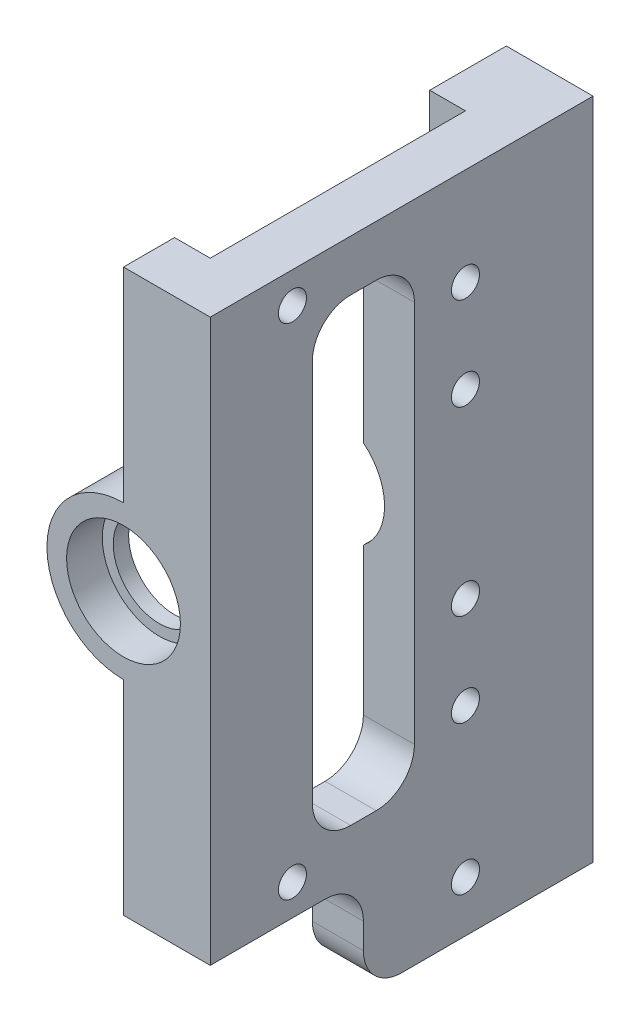
from build123d import *
from build123d.topology import SkipClean

# Parameters (mm, degrees)
SKETCH2_R               = 15
SKETCH2_R_2             = 11.15
BOSS_EXTRUDE1_DEPTH     = 7
SKETCH3_R               = 15
SKETCH3_R_2             = 9
BOSS_EXTRUDE2_DEPTH     = 3
BOSS_EXTRUDE3_START     = 5
SKETCH4_R               = 15
SKETCH4_R_2             = 11.15
BOSS_EXTRUDE3_DEPTH     = 5
BOSS_EXTRUDE4_DEPTH     = 8
BOSS_EXTRUDE5_START     = 20
SKETCH7_W               = 10
SKETCH7_H               = 30
BOSS_EXTRUDE5_DEPTH     = 20
BOSS_EXTRUDE6_DEPTH     = 7
SKETCH10_W              = 2
SKETCH10_H              = 90
CUT_EXTRUDE1_DEPTH      = 20
SKETCH12_R              = 2.75
CUT_EXTRUDE2_DEPTH      = 20
BOSS_EXTRUDE7_DEPTH     = 10
BOSS_EXTRUDE8_DEPTH     = 10
SKETCH15_W              = 10
SKETCH15_H              = 10
BOSS_EXTRUDE9_DEPTH     = 20
SKETCH16_W              = 10
SKETCH16_H              = 10
BOSS_EXTRUDE10_DEPTH    = 10
SKETCH17_W              = 10
SKETCH17_H              = 10
BOSS_EXTRUDE11_DEPTH    = 90
FILLET1_R               = 7.5
BOSS_EXTRUDE12_START    = 10
SKETCH18_R              = 11.15
BOSS_EXTRUDE12_DEPTH    = 10
BOSS_EXTRUDE13_START    = -3
SKETCH19_R              = 9
BOSS_EXTRUDE13_DEPTH    = 3
CUT_EXTRUDE3_DEPTH      = 88.943163464
CUT_EXTRUDE3_DEPTH_BACK = 88.943163464
SKETCH21_W              = 10
SKETCH21_H              = 10
BOSS_EXTRUDE14_DEPTH    = 20
SKETCH22_W              = 10
SKETCH22_H              = 20
BOSS_EXTRUDE15_DEPTH    = 20
FILLET2_R               = 7.5
SKETCH23_R              = 2.75
CUT_EXTRUDE4_DEPTH      = 20


with BuildPart() as part:
    # Sketch2 → Boss-Extrude1 (new body)
    with BuildSketch(Plane.XY):
        Circle(SKETCH2_R)
        Circle(SKETCH2_R_2, mode=Mode.SUBTRACT)
    extrude(amount=-BOSS_EXTRUDE1_DEPTH)

    # Sketch3 → Boss-Extrude2 (add)
    with BuildSketch(Plane(origin=(0, 0, -7), x_dir=(-1, 0, 0), z_dir=(0, 0, -1))):
        with Locations(Location((0, 0, 0), (0, 0, 180))):
            Circle(SKETCH3_R)
        Circle(SKETCH3_R_2, mode=Mode.SUBTRACT)
    extrude(amount=BOSS_EXTRUDE2_DEPTH)

    # Sketch4 → Boss-Extrude3 (add)
    with BuildSketch(Plane.XY.offset(BOSS_EXTRUDE3_START)):
        Circle(SKETCH4_R)
        Circle(SKETCH4_R_2, mode=Mode.SUBTRACT)
    extrude(amount=-BOSS_EXTRUDE3_DEPTH)

    # Sketch5 → Boss-Extrude4 (add)
    with BuildSketch(Plane.XY.offset(5)):
        with BuildLine():
            Line((0, 45), (0, 15))
            ThreePointArc((0, 15), (10.606601718, 10.606601718), (15, 0))
            ThreePointArc((15, 0), (10.606601718, -10.606601718), (0, -15))
            Line((0, -15), (0, -45))
            Line((0, -45), (17, -45))
            Line((17, -45), (17, 15))
            Line((17, 15), (17, 45))
            Line((17, 45), (0, 45))
        make_face()
    extrude(amount=-BOSS_EXTRUDE4_DEPTH)

    # Sketch7 → Boss-Extrude5 (add)
    with SkipClean():  # the faces are left unmerged after this step: merging them gives an invalid solid
        with BuildSketch(Plane.XY.offset(5).offset(BOSS_EXTRUDE5_START)):
            with Locations((12, 30)):
                Rectangle(SKETCH7_W, SKETCH7_H)
            with BuildLine():
                Line((7, -15), (17, -15))
                Line((17, -15), (17, 15))
                Line((17, 15), (7, 15))
                Line((7, 15), (7, 8.678853611))
                ThreePointArc((7, 8.678853611), (10.059137637, 4.810015592), (11.15, 0))
                ThreePointArc((11.15, 0), (10.059137637, -4.810015592), (7, -8.678853611))
                Line((7, -8.678853611), (7, -15))
            make_face()
            with Locations((12, -30)):
                Rectangle(SKETCH7_W, SKETCH7_H)
        extrude(amount=-BOSS_EXTRUDE5_DEPTH)

    # Sketch9 → Boss-Extrude6 (add)
    with SkipClean():  # the faces are left unmerged after this step: merging them gives an invalid solid
        with BuildSketch(Plane(origin=(0, 0, -3), x_dir=(-1, 0, 0), z_dir=(0, 0, -1))):
            with BuildLine():
                Line((-17, -45), (0, -45))
                Line((0, -45), (0, -15))
                ThreePointArc((0, -15), (-15, 0), (0, 15))
                Line((0, 15), (0, 45))
                Line((0, 45), (-17, 45))
                Line((-17, 45), (-17, -45))
            make_face()
        extrude(amount=BOSS_EXTRUDE6_DEPTH)

    # Sketch10 → Cut-Extrude1 (cut)
    with BuildSketch(Plane.ZY):
        with Locations((4, 0)):
            Rectangle(SKETCH10_W, SKETCH10_H)
    extrude(amount=CUT_EXTRUDE1_DEPTH, mode=Mode.SUBTRACT)

    # Sketch12 → Cut-Extrude2 (cut)
    with BuildSketch(Plane.ZY.offset(-7)):
        with Locations((15, -35.919713403)):
            Circle(SKETCH12_R)
        with Locations((15, -17.759140208)):
            Circle(SKETCH12_R)
        with Locations((15, 17.759140208)):
            Circle(SKETCH12_R)
        with BuildLine():
            ThreePointArc((17.75, 35.919713403), (16.944543648, 37.864257051), (15, 38.669713403))
            Line((15, 38.669713403), (15, 33.169713403))
            ThreePointArc((15, 33.169713403), (16.944543648, 33.975169754), (17.75, 35.919713403))
        make_face()
        with BuildLine():
            Line((15, 33.169713403), (15, 38.669713403))
            ThreePointArc((15, 38.669713403), (12.25, 35.919713403), (15, 33.169713403))
        make_face()
    extrude(amount=-CUT_EXTRUDE2_DEPTH, mode=Mode.SUBTRACT)

    # Sketch13 → Boss-Extrude7 (add)
    with BuildSketch(Plane.XZ.offset(45)):
        Polygon((7, 5), (0, 5), (0, -10), (17, -10), (17, 25), (7, 25), align=None)
    extrude(amount=BOSS_EXTRUDE7_DEPTH)

    # Sketch14 → Boss-Extrude8 (add)
    with BuildSketch(Plane(origin=(0, 45, 0), x_dir=(1, 0, 0), z_dir=(0, 1, 0))):
        Polygon((0, -5), (7, -5), (7, -25), (17, -25), (17, 10), (0, 10), align=None)
    extrude(amount=BOSS_EXTRUDE8_DEPTH)

    # Sketch15 → Boss-Extrude9 (add)
    with BuildSketch(Plane.XY.offset(25)):
        with Locations((12, 50)):
            Rectangle(SKETCH15_W, SKETCH15_H)
        with Locations((12, -50)):
            Rectangle(SKETCH15_W, SKETCH15_H)
    extrude(amount=BOSS_EXTRUDE9_DEPTH)

    # Sketch16 → Boss-Extrude10 (add)
    with BuildSketch(Plane.XY.offset(45)):
        with Locations((12, 50)):
            Rectangle(SKETCH16_W, SKETCH16_H)
        with Locations((12, -50)):
            Rectangle(SKETCH16_W, SKETCH16_H)
    extrude(amount=BOSS_EXTRUDE10_DEPTH)

    # Sketch17 → Boss-Extrude11 (add)
    with BuildSketch(Plane(origin=(0, -45, 0), x_dir=(1, 0, 0), z_dir=(0, 1, 0))):
        with Locations((12, -50)):
            Rectangle(SKETCH17_W, SKETCH17_H)
    extrude(amount=BOSS_EXTRUDE11_DEPTH)

    # Fillet1
    fillet1_edges = [part.edges().sort_by_distance(p)[0] for p in [
        (12, 45, 25),
        (12, -45, 25),
        (12, -45, 45),
        (12, 45, 45),
    ]]
    fillet(fillet1_edges, radius=FILLET1_R)

    # Sketch18 → Boss-Extrude12 (add)
    with BuildSketch(Plane.XY.offset(55).offset(BOSS_EXTRUDE12_START)):
        with BuildLine():
            ThreePointArc((0, 15), (-15, 0), (0, -15))
            Line((0, -15), (0, -55))
            Line((0, -55), (17, -55))
            Line((17, -55), (17, 55))
            Line((17, 55), (0, 55))
            Line((0, 55), (0, 15))
        make_face()
        Circle(SKETCH18_R, mode=Mode.SUBTRACT)
    extrude(amount=-BOSS_EXTRUDE12_DEPTH)

    # Sketch19 → Boss-Extrude13 (add)
    with BuildSketch(Plane(origin=(0, 0, 55), x_dir=(-1, 0, 0), z_dir=(0, 0, -1)).offset(BOSS_EXTRUDE13_START)):
        with BuildLine():
            Line((0, 15), (0, 55))
            Line((0, 55), (-17, 55))
            Line((-17, 55), (-17, -55))
            Line((-17, -55), (0, -55))
            Line((0, -55), (0, -15))
            ThreePointArc((0, -15), (15, 0), (0, 15))
        make_face()
        Circle(SKETCH19_R, mode=Mode.SUBTRACT)
    extrude(amount=BOSS_EXTRUDE13_DEPTH)

    # Sketch20 → Cut-Extrude3 (cut, two sides: drawn at the far end of the back side and taken through both)
    with BuildSketch(Plane.ZY.offset(-7).offset(-CUT_EXTRUDE3_DEPTH_BACK)):
        with BuildLine():
            ThreePointArc((51.651650429, -48.901650429), (49.954029868, -46.360981715), (46.957106781, -46.957106781))
            Line((46.957106781, -46.957106781), (50.846194078, -50.846194078))
            ThreePointArc((50.846194078, -50.846194078), (51.442319144, -49.954029868), (51.651650429, -48.901650429))
        make_face()
        with BuildLine():
            Line((50.846194078, -50.846194078), (46.957106781, -46.957106781))
            ThreePointArc((46.957106781, -46.957106781), (46.957106781, -50.846194078), (50.846194078, -50.846194078))
        make_face()
        with BuildLine():
            ThreePointArc((51.651650429, 48.901650429), (51.442319144, 49.954029868), (50.846194078, 50.846194078))
            Line((50.846194078, 50.846194078), (46.957106781, 46.957106781))
            ThreePointArc((46.957106781, 46.957106781), (49.954029868, 46.360981715), (51.651650429, 48.901650429))
        make_face()
        with BuildLine():
            Line((46.957106781, 46.957106781), (50.846194078, 50.846194078))
            ThreePointArc((50.846194078, 50.846194078), (46.957106781, 50.846194078), (46.957106781, 46.957106781))
        make_face()
    extrude(amount=CUT_EXTRUDE3_DEPTH + CUT_EXTRUDE3_DEPTH_BACK, mode=Mode.SUBTRACT)

    # Sketch21 → Boss-Extrude14 (add)
    with BuildSketch(Plane.XZ.offset(55)):
        Polygon((0, 5), (0, -10), (17, -10), (17, 5), (7, 5), align=None)
        with Locations((12, 10)):
            Rectangle(SKETCH21_W, SKETCH21_H)
    extrude(amount=BOSS_EXTRUDE14_DEPTH)

    # Sketch22 → Boss-Extrude15 (add)
    with BuildSketch(Plane.XY.offset(15)):
        with Locations((12, -65)):
            Rectangle(SKETCH22_W, SKETCH22_H)
    extrude(amount=BOSS_EXTRUDE15_DEPTH)

    # Fillet2
    fillet2_edges = [part.edges().sort_by_distance(p)[0] for p in [
        (12, -55, 35),
        (12, -75, 35),
    ]]
    fillet(fillet2_edges, radius=FILLET2_R)

    # Sketch23 → Cut-Extrude4 (cut)
    with BuildSketch(Plane.ZY.offset(-7)):
        with Locations((15, -65)):
            Circle(SKETCH23_R)
    extrude(amount=-CUT_EXTRUDE4_DEPTH, mode=Mode.SUBTRACT)


solid = part.part
